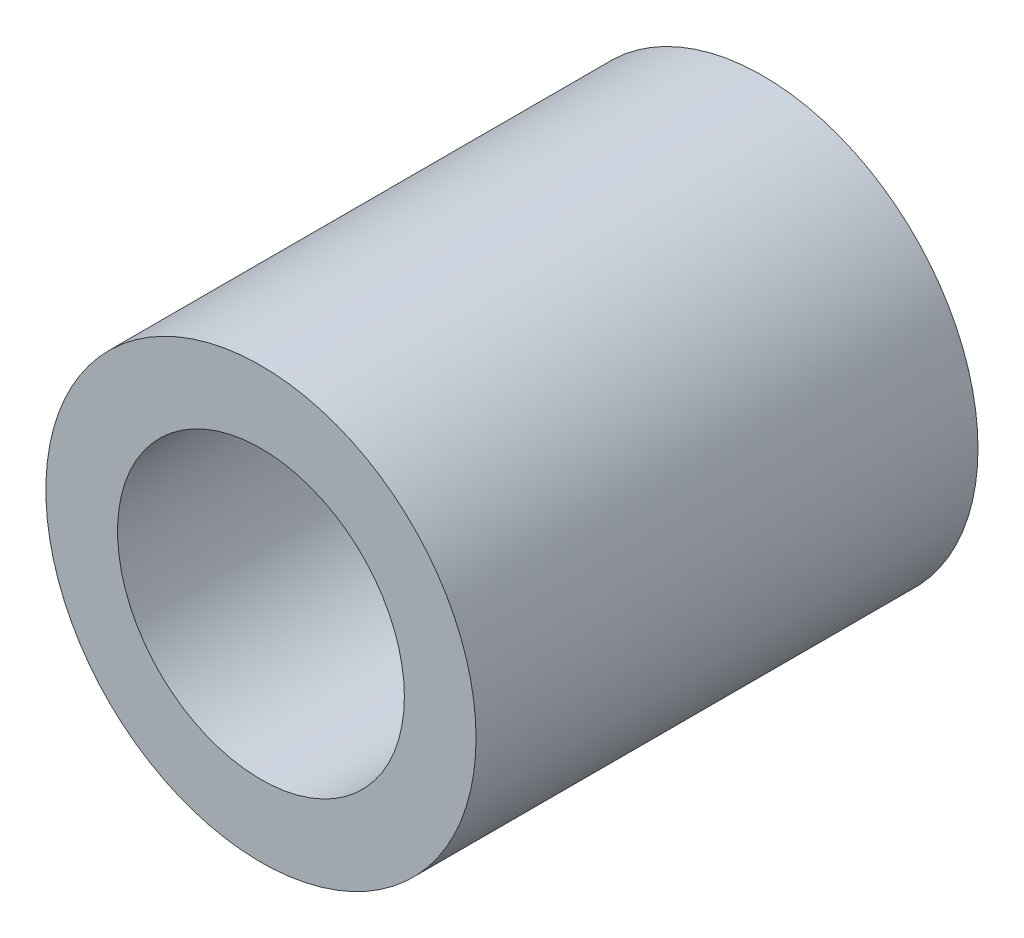
from build123d import *

# Parameters (mm, degrees)
SKETCH_1_R      = 3
SKETCH_1_R_2    = 2
EXTRUDE_1_DEPTH = 7


with BuildPart() as part:
    # 草图1 → 凸台-拉伸1 (new body)
    with BuildSketch(Plane.XY):
        Circle(SKETCH_1_R)
        Circle(SKETCH_1_R_2, mode=Mode.SUBTRACT)
    extrude(amount=EXTRUDE_1_DEPTH)


solid = part.part
